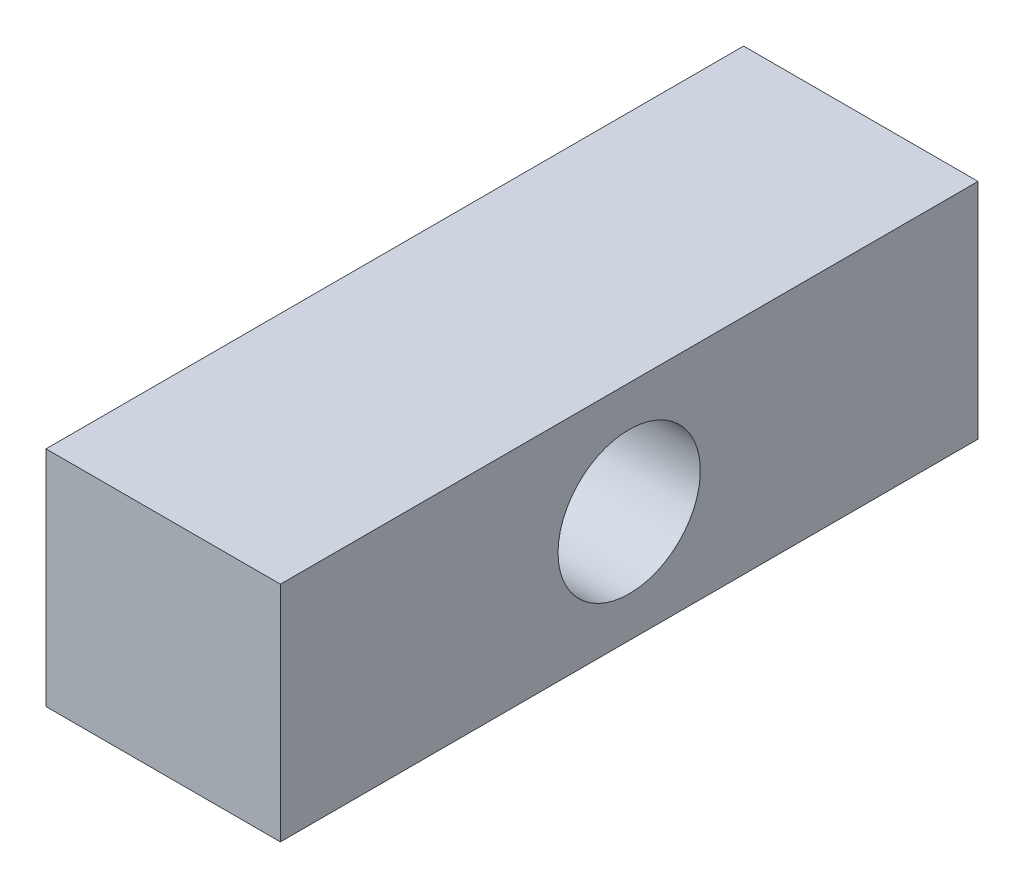
from build123d import *

# Parameters (mm, degrees)
SKETCH_1_W      = 500
SKETCH_1_H      = 160
SKETCH_1_R      = 51
EXTRUDE_1_DEPTH = 168


with BuildPart() as part:
    # 草图1 → 凸台-拉伸1 (new body)
    with BuildSketch(Plane(origin=(0, 0, 0), x_dir=(0, 0, -1), z_dir=(1, 0, 0))):
        Rectangle(SKETCH_1_W, SKETCH_1_H)
        with Locations(Location((0, 0, 0), (0, 0, 180))):
            Circle(SKETCH_1_R, mode=Mode.SUBTRACT)
    extrude(amount=EXTRUDE_1_DEPTH)


solid = part.part
